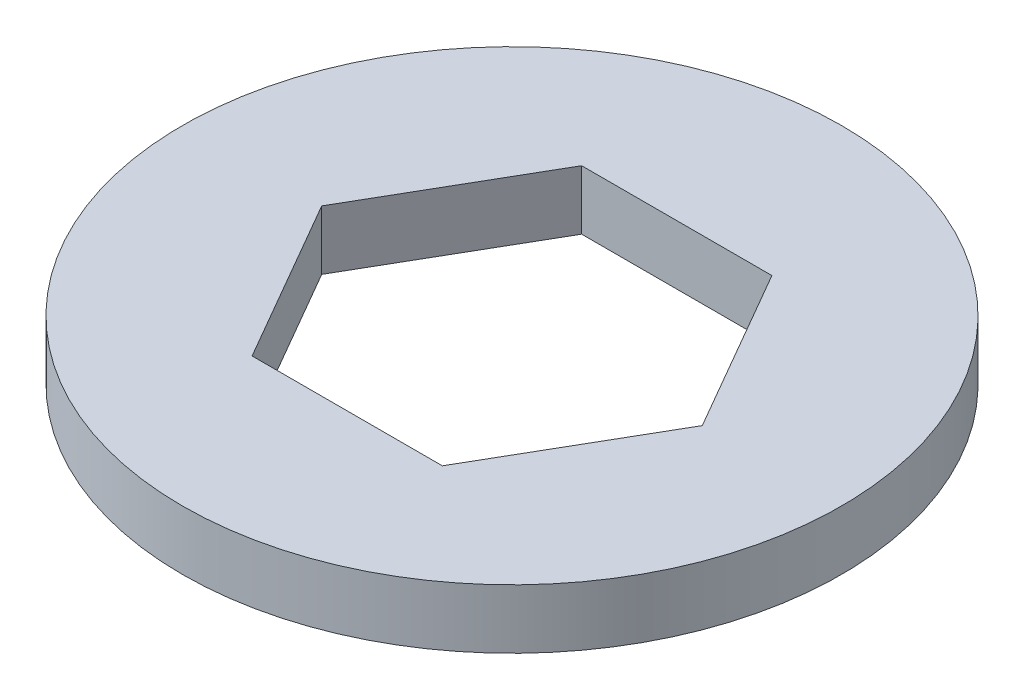
from build123d import *

# Parameters (mm, degrees)
SKETCH1_R           = 12.7
BOSS_EXTRUDE1_DEPTH = 1.143


with BuildPart() as part:
    # Sketch1 → Boss-Extrude1 (new, symmetric)
    with BuildSketch(Plane(origin=(0, 0, 0), x_dir=(1, 0, 0), z_dir=(0, 1, 0))):
        with Locations(Location((0, 0, 0), (0, 0, 270))):
            Circle(SKETCH1_R)
        Polygon((3.666174209, 6.35), (-3.666174209, 6.35), (-7.332348419, 0), (-3.666174209, -6.35), (3.666174209, -6.35), (7.332348419, 0), align=None, mode=Mode.SUBTRACT)
    extrude(amount=BOSS_EXTRUDE1_DEPTH, both=True)


solid = part.part
